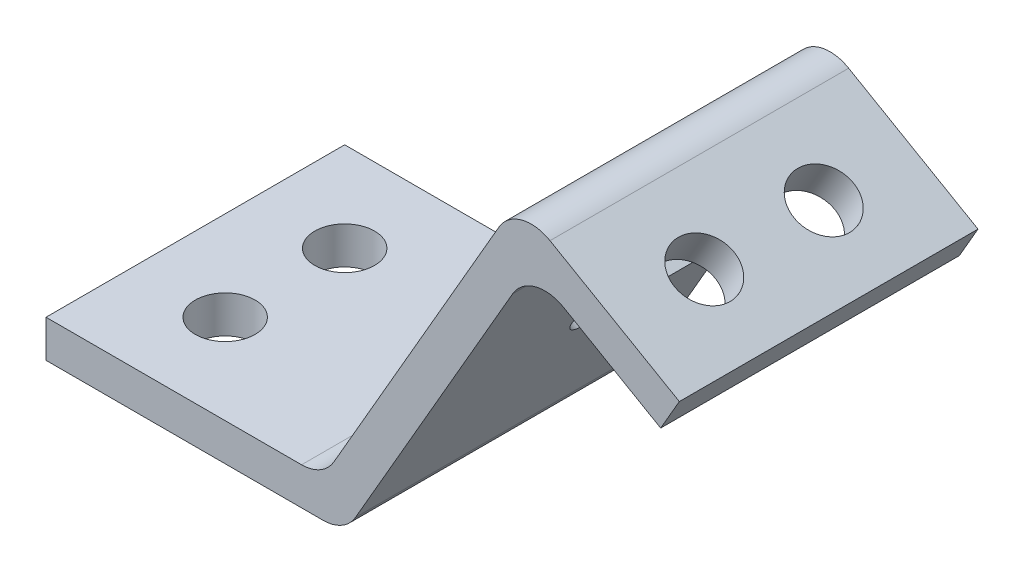
from build123d import *

# Parameters (mm, degrees)
BOSS_EXTRUDE1_DEPTH = 40
SKETCH2_R           = 4
CUT_EXTRUDE1_DEPTH  = 40
CUT_EXTRUDE2_REACH  = 97.306
CUT_EXTRUDE3_REACH  = 91.766
SKETCH4_R           = 4


with BuildPart() as part:
    # Sketch1 → Boss-Extrude1 (new body)
    with BuildSketch(Plane.XY):
        with BuildLine():
            Line((0, 5), (0, 0))
            Line((0, 0), (37.113248654, 0))
            ThreePointArc((37.113248654, 0), (39.613248654, 0.669872981), (41.443375673, 2.5))
            Line((41.443375673, 2.5), (62.5, 38.97114317))
            ThreePointArc((62.5, 38.97114317), (65.536031793, 41.300772302), (69.330127019, 40.801270189))
            Line((69.330127019, 40.801270189), (82.320508076, 33.301270189))
            Line((82.320508076, 33.301270189), (84.820508076, 37.631397208))
            Line((84.820508076, 37.631397208), (67.5, 47.631397208))
            ThreePointArc((67.5, 47.631397208), (63.705904774, 48.130899321), (60.669872981, 45.801270189))
            Line((60.669872981, 45.801270189), (38.556624327, 7.5))
            ThreePointArc((38.556624327, 7.5), (36.726497308, 5.669872981), (34.226497308, 5))
            Line((34.226497308, 5), (0, 5))
        make_face()
    extrude(amount=BOSS_EXTRUDE1_DEPTH)

    # Sketch2 → Cut-Extrude1 (cut)
    with BuildSketch(Plane(origin=(0, 5, 0), x_dir=(1, 0, 0), z_dir=(0, 1, 0))):
        with Locations(Location((12, -12, 0), (0, 0, 270))):
            Circle(SKETCH2_R)
        with Locations(Location((12, -28, 0), (0, 0, 270))):
            Circle(SKETCH2_R)
    extrude(amount=-CUT_EXTRUDE1_DEPTH, mode=Mode.SUBTRACT)

    # Sketch3 → Cut-Extrude2 (cut, up to next)
    with BuildSketch(Plane(origin=(25.669872981, -14.820508076, 0), x_dir=(0, 0, 1), z_dir=(-0.86602540378444, 0.49999999999999784, 0)), mode=Mode.PRIVATE) as cut_extrude2_sk1:
        with BuildLine():
            Line((19, 48), (0, 48))
            Line((0, 48), (0, 42))
            Line((0, 42), (19, 42))
            ThreePointArc((19, 42), (22, 45), (19, 48))
        make_face()
    cut_extrude2_tool1 = extrude(cut_extrude2_sk1.sketch, amount=-CUT_EXTRUDE2_REACH, mode=Mode.PRIVATE) & part.part
    add(cut_extrude2_tool1.solids().sort_by_distance((48.169873, 24.150635, 10.688594))[0], mode=Mode.SUBTRACT)

    # Sketch4 → Cut-Extrude3 (cut, up to next)
    with BuildSketch(Plane(origin=(37.5, 64.951905284, 0), x_dir=(0.8660254037844429, -0.49999999999999284, 0), z_dir=(0.49999999999999284, 0.8660254037844429, 0)), mode=Mode.PRIVATE) as cut_extrude3_sk1:
        with Locations(Location((44.641016151, -28, 0), (0, 0, 180))):
            Circle(SKETCH4_R)
    cut_extrude3_tool1 = extrude(cut_extrude3_sk1.sketch, amount=-CUT_EXTRUDE3_REACH, mode=Mode.PRIVATE) & part.part
    # Sketch4 → Cut-Extrude3 (cut, up to next)
    with BuildSketch(Plane(origin=(37.5, 64.951905284, 0), x_dir=(0.8660254037844429, -0.49999999999999284, 0), z_dir=(0.49999999999999284, 0.8660254037844429, 0)), mode=Mode.PRIVATE) as cut_extrude3_sk2:
        with Locations(Location((44.641016151, -12, 0), (0, 0, 180))):
            Circle(SKETCH4_R)
    cut_extrude3_tool2 = extrude(cut_extrude3_sk2.sketch, amount=-CUT_EXTRUDE3_REACH, mode=Mode.PRIVATE) & part.part
    add(cut_extrude3_tool1.solids().sort_by_distance((76.160254, 42.631397, 28))[0], mode=Mode.SUBTRACT)
    add(cut_extrude3_tool2.solids().sort_by_distance((76.160254, 42.631397, 12))[0], mode=Mode.SUBTRACT)


solid = part.part
